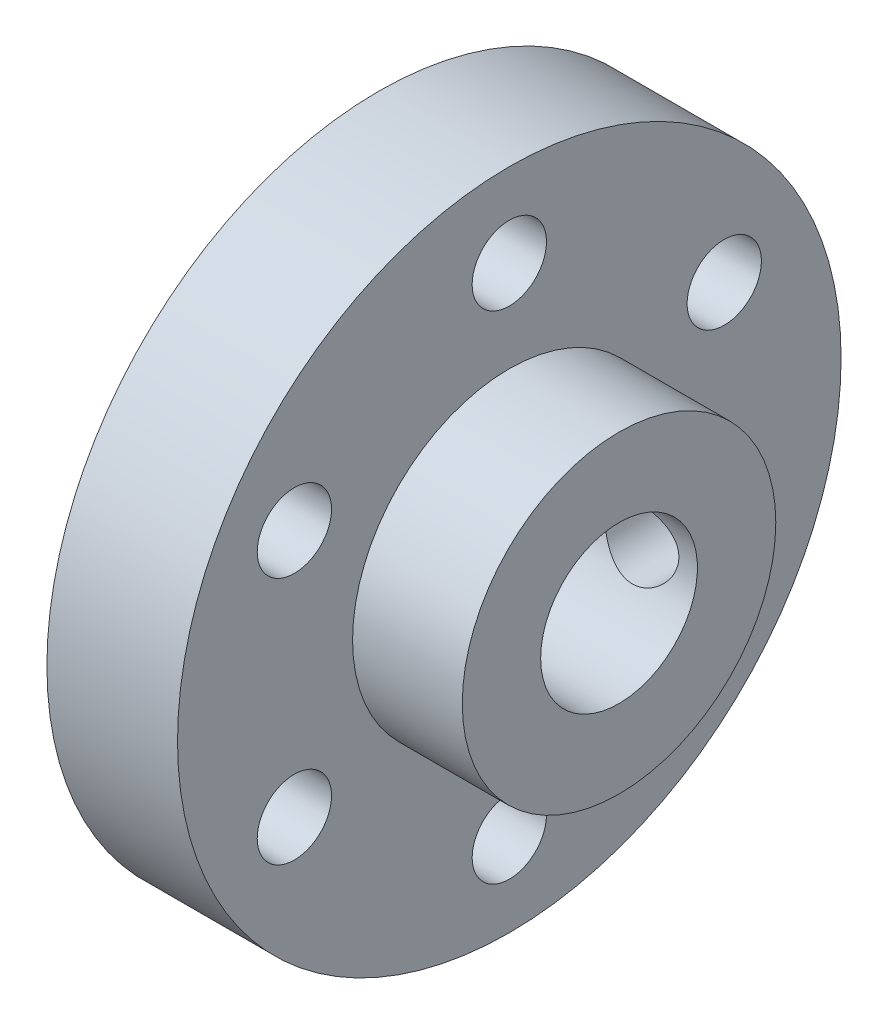
from build123d import *

# Parameters (mm, degrees)
SKETCH1_R           = 12.7
BOSS_EXTRUDE1_DEPTH = 9.2
CUT_EXTRUDE1_START  = -4.2
SKETCH2_R           = 12.7
SKETCH2_R_2         = 6
CUT_EXTRUDE1_DEPTH  = 4.2
SKETCH4_R           = 3
SKETCH4_R_2         = 1.4224
CUT_EXTRUDE2_DEPTH  = 21.179692763
SKETCH5_R           = 1.4224
CUT_EXTRUDE3_DEPTH  = 21.179692763


with BuildPart() as part:
    # Sketch1 → Boss-Extrude1 (new body)
    with BuildSketch(Plane(origin=(0, 0, 0), x_dir=(0, 0, -1), z_dir=(1, 0, 0))):
        Circle(SKETCH1_R)
    extrude(amount=BOSS_EXTRUDE1_DEPTH)

    # Sketch2 → Cut-Extrude1 (cut)
    with BuildSketch(Plane(origin=(9.2, 0, 0), x_dir=(0, 0, -1), z_dir=(1, 0, 0)).offset(CUT_EXTRUDE1_START)):
        Circle(SKETCH2_R)
        Circle(SKETCH2_R_2, mode=Mode.SUBTRACT)
    extrude(amount=CUT_EXTRUDE1_DEPTH, mode=Mode.SUBTRACT)

    # Sketch4 → Cut-Extrude2 (cut, through all)
    with BuildSketch(Plane.ZY):
        Circle(SKETCH4_R)
        with Locations((-8.227241336, -4.75)):
            Circle(SKETCH4_R_2)
        with Locations((8.227241336, 4.75)):
            Circle(SKETCH4_R_2)
        with Locations((-8.227241336, 4.75)):
            Circle(SKETCH4_R_2)
        with Locations((0, 9.5)):
            Circle(SKETCH4_R_2)
        with Locations((0, -9.5)):
            Circle(SKETCH4_R_2)
        with Locations((8.227241336, -4.75)):
            Circle(SKETCH4_R_2)
    extrude(amount=-CUT_EXTRUDE2_DEPTH, mode=Mode.SUBTRACT)

    # Sketch5 → Cut-Extrude3 (cut, through all)
    with BuildSketch(Plane.XY):
        with Locations((2.469287496, 0)):
            Circle(SKETCH5_R)
        with Locations((7.069287496, 0)):
            Circle(SKETCH5_R)
    extrude(amount=-CUT_EXTRUDE3_DEPTH, mode=Mode.SUBTRACT)


solid = part.part
